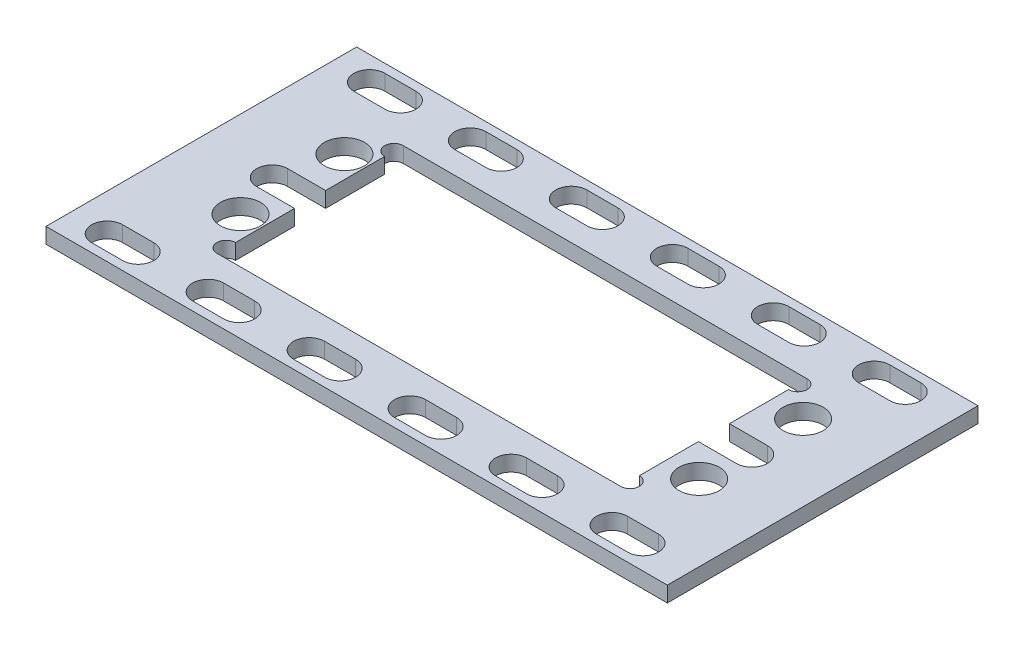
from build123d import *

# Parameters (mm, degrees)
SKETCH1_W           = 101.6
SKETCH1_H           = 50.8
BOSS_EXTRUDE1_DEPTH = 2.54
CUT_EXTRUDE1_DEPTH  = 57.852894385
CUT_EXTRUDE2_DEPTH  = 57.852894385
SKETCH4_R           = 3.302
CUT_EXTRUDE3_DEPTH  = 57.852894385


with BuildPart() as part:
    # Sketch1 → Boss-Extrude1 (new body)
    with BuildSketch(Plane(origin=(0, 0, 0), x_dir=(1, 0, 0), z_dir=(0, 1, 0))):
        Rectangle(SKETCH1_W, SKETCH1_H)
        with BuildLine():
            Line((-33.02, 15.24), (33.02, 15.24))
            ThreePointArc((33.02, 15.24), (34.544, 13.716), (33.02, 12.192))
            Line((33.02, 12.192), (33.02, -12.192))
            ThreePointArc((33.02, -12.192), (34.544, -13.716), (33.02, -15.24))
            Line((33.02, -15.24), (-33.02, -15.24))
            ThreePointArc((-33.02, -15.24), (-34.544, -13.716), (-33.02, -12.192))
            Line((-33.02, -12.192), (-33.02, 12.192))
            ThreePointArc((-33.02, 12.192), (-34.544, 13.716), (-33.02, 15.24))
        make_face(mode=Mode.SUBTRACT)
    extrude(amount=BOSS_EXTRUDE1_DEPTH)

    # Sketch2 → Cut-Extrude1 (cut, through all)
    with BuildSketch(Plane(origin=(0, 2.54, 0), x_dir=(1, 0, 0), z_dir=(0, 1, 0))):
        with BuildLine():
            Line((-44.759454191, -18.898986355), (-39.679454191, -18.898986355))
            ThreePointArc((-39.679454191, -18.898986355), (-37.139454191, -21.438986355), (-39.679454191, -23.978986355))
            Line((-39.679454191, -23.978986355), (-44.759454191, -23.978986355))
            ThreePointArc((-44.759454191, -23.978986355), (-47.299454191, -21.438986355), (-44.759454191, -18.898986355))
        make_face()
        with BuildLine():
            Line((-28.249454191, -23.978986355), (-23.169454191, -23.978986355))
            ThreePointArc((-23.169454191, -23.978986355), (-20.629454191, -21.438986355), (-23.169454191, -18.898986355))
            Line((-23.169454191, -18.898986355), (-28.249454191, -18.898986355))
            ThreePointArc((-28.249454191, -18.898986355), (-30.789454191, -21.438986355), (-28.249454191, -23.978986355))
        make_face()
        with BuildLine():
            Line((-11.739454191, -23.978986355), (-6.659454191, -23.978986355))
            ThreePointArc((-6.659454191, -23.978986355), (-4.119454191, -21.438986355), (-6.659454191, -18.898986355))
            Line((-6.659454191, -18.898986355), (-11.739454191, -18.898986355))
            ThreePointArc((-11.739454191, -18.898986355), (-14.279454191, -21.438986355), (-11.739454191, -23.978986355))
        make_face()
        with BuildLine():
            Line((4.770545809, -23.978986355), (9.850545809, -23.978986355))
            ThreePointArc((9.850545809, -23.978986355), (12.390545809, -21.438986355), (9.850545809, -18.898986355))
            Line((9.850545809, -18.898986355), (4.770545809, -18.898986355))
            ThreePointArc((4.770545809, -18.898986355), (2.230545809, -21.438986355), (4.770545809, -23.978986355))
        make_face()
        with BuildLine():
            Line((21.280545809, -23.978986355), (26.360545809, -23.978986355))
            ThreePointArc((26.360545809, -23.978986355), (28.900545809, -21.438986355), (26.360545809, -18.898986355))
            Line((26.360545809, -18.898986355), (21.280545809, -18.898986355))
            ThreePointArc((21.280545809, -18.898986355), (18.740545809, -21.438986355), (21.280545809, -23.978986355))
        make_face()
        with BuildLine():
            Line((37.790545809, -23.978986355), (42.870545809, -23.978986355))
            ThreePointArc((42.870545809, -23.978986355), (45.410545809, -21.438986355), (42.870545809, -18.898986355))
            Line((42.870545809, -18.898986355), (37.790545809, -18.898986355))
            ThreePointArc((37.790545809, -18.898986355), (35.250545809, -21.438986355), (37.790545809, -23.978986355))
        make_face()
        with BuildLine():
            Line((-28.249454191, 18.898986355), (-23.169454191, 18.898986355))
            ThreePointArc((-23.169454191, 18.898986355), (-20.629454191, 21.438986355), (-23.169454191, 23.978986355))
            Line((-23.169454191, 23.978986355), (-28.249454191, 23.978986355))
            ThreePointArc((-28.249454191, 23.978986355), (-30.789454191, 21.438986355), (-28.249454191, 18.898986355))
        make_face()
        with BuildLine():
            Line((37.790545809, 18.898986355), (42.870545809, 18.898986355))
            ThreePointArc((42.870545809, 18.898986355), (45.410545809, 21.438986355), (42.870545809, 23.978986355))
            Line((42.870545809, 23.978986355), (37.790545809, 23.978986355))
            ThreePointArc((37.790545809, 23.978986355), (35.250545809, 21.438986355), (37.790545809, 18.898986355))
        make_face()
        with BuildLine():
            Line((21.280545809, 18.898986355), (26.360545809, 18.898986355))
            ThreePointArc((26.360545809, 18.898986355), (28.900545809, 21.438986355), (26.360545809, 23.978986355))
            Line((26.360545809, 23.978986355), (21.280545809, 23.978986355))
            ThreePointArc((21.280545809, 23.978986355), (18.740545809, 21.438986355), (21.280545809, 18.898986355))
        make_face()
        with BuildLine():
            Line((4.770545809, 18.898986355), (9.850545809, 18.898986355))
            ThreePointArc((9.850545809, 18.898986355), (12.390545809, 21.438986355), (9.850545809, 23.978986355))
            Line((9.850545809, 23.978986355), (4.770545809, 23.978986355))
            ThreePointArc((4.770545809, 23.978986355), (2.230545809, 21.438986355), (4.770545809, 18.898986355))
        make_face()
        with BuildLine():
            Line((-11.739454191, 18.898986355), (-6.659454191, 18.898986355))
            ThreePointArc((-6.659454191, 18.898986355), (-4.119454191, 21.438986355), (-6.659454191, 23.978986355))
            Line((-6.659454191, 23.978986355), (-11.739454191, 23.978986355))
            ThreePointArc((-11.739454191, 23.978986355), (-14.279454191, 21.438986355), (-11.739454191, 18.898986355))
        make_face()
        with BuildLine():
            Line((-44.759454191, 18.898986355), (-39.679454191, 18.898986355))
            ThreePointArc((-39.679454191, 18.898986355), (-37.139454191, 21.438986355), (-39.679454191, 23.978986355))
            Line((-39.679454191, 23.978986355), (-44.759454191, 23.978986355))
            ThreePointArc((-44.759454191, 23.978986355), (-47.299454191, 21.438986355), (-44.759454191, 18.898986355))
        make_face()
    extrude(amount=-CUT_EXTRUDE1_DEPTH, mode=Mode.SUBTRACT)

    # Sketch3 → Cut-Extrude2 (cut, through all)
    with BuildSketch(Plane(origin=(0, 2.54, 0), x_dir=(1, 0, 0), z_dir=(0, 1, 0))):
        with BuildLine():
            Line((-33.02, -2.54), (-39.214035088, -2.54))
            ThreePointArc((-39.214035088, -2.54), (-41.754035088, 0), (-39.214035088, 2.54))
            Line((-39.214035088, 2.54), (-33.02, 2.54))
            ThreePointArc((-33.02, 2.54), (-30.48, 0), (-33.02, -2.54))
        make_face()
        with BuildLine():
            Line((33.02, -2.54), (39.214035088, -2.54))
            ThreePointArc((39.214035088, -2.54), (41.754035088, 0), (39.214035088, 2.54))
            Line((39.214035088, 2.54), (33.02, 2.54))
            ThreePointArc((33.02, 2.54), (30.48, 0), (33.02, -2.54))
        make_face()
    extrude(amount=-CUT_EXTRUDE2_DEPTH, mode=Mode.SUBTRACT)

    # Sketch4 → Cut-Extrude3 (cut, through all)
    with BuildSketch(Plane(origin=(0, 2.54, 0), x_dir=(1, 0, 0), z_dir=(0, 1, 0))):
        with Locations(Location((-36.633918246, -7.763735779, 0), (0, 0, 270))):
            Circle(SKETCH4_R)
        with Locations(Location((-36.633918246, 9.236264221, 0), (0, 0, 270))):
            Circle(SKETCH4_R)
        with Locations(Location((38.366081754, -7.763735779, 0), (0, 0, 270))):
            Circle(SKETCH4_R)
        with Locations(Location((38.366081754, 9.236264221, 0), (0, 0, 270))):
            Circle(SKETCH4_R)
    extrude(amount=-CUT_EXTRUDE3_DEPTH, mode=Mode.SUBTRACT)


solid = part.part
